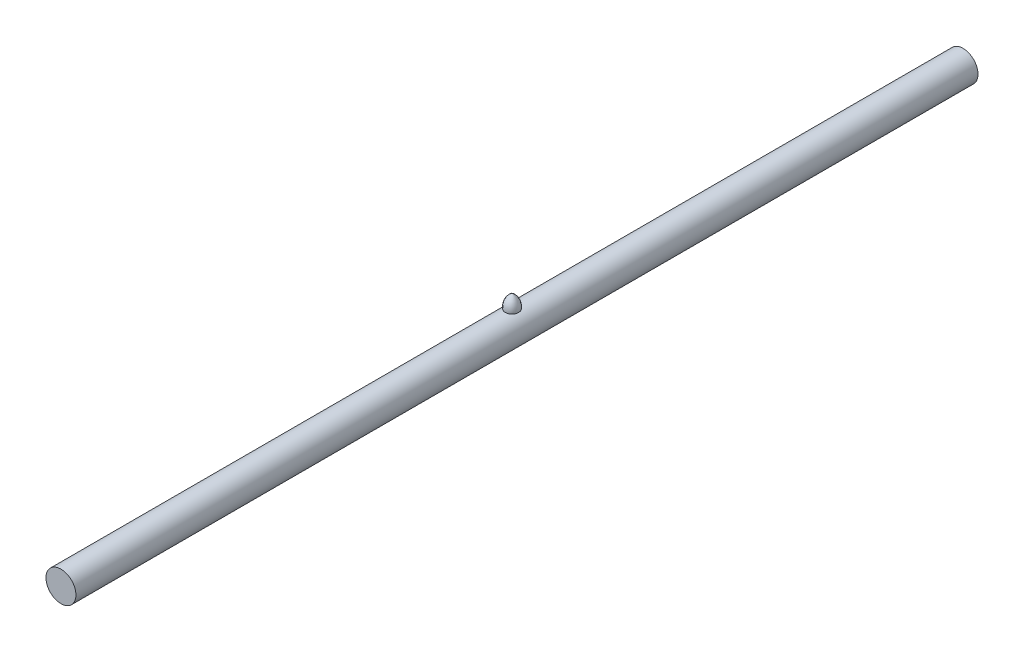
from build123d import *

# Parameters (mm, degrees)
SKETCH1_R           = 2.8575
BOSS_EXTRUDE1_DEPTH = 172.085


with BuildPart() as part:
    # Sketch1 → Boss-Extrude1 (new body)
    with BuildSketch(Plane.XY):
        Circle(SKETCH1_R)
    extrude(amount=BOSS_EXTRUDE1_DEPTH)


with BuildPart() as body_2:
    # Sketch2 → Revolve1 (revolve)
    with BuildSketch(Plane(origin=(0, 0, 0), x_dir=(0, 0, -1), z_dir=(1, 0, 0))):
        with BuildLine():
            Line((-84.7725, 2.8575), (-86.0425, 2.8575))
            Line((-86.0425, 2.8575), (-86.0425, 5.3975))
            ThreePointArc((-86.0425, 5.3975), (-85.019369351, 4.321565325), (-84.7725, 2.8575))
        make_face()
    revolve(axis=Axis((0, 5.3975, 86.0425), (0, -1, 0)))


solid = Compound([part.part, body_2.part])
